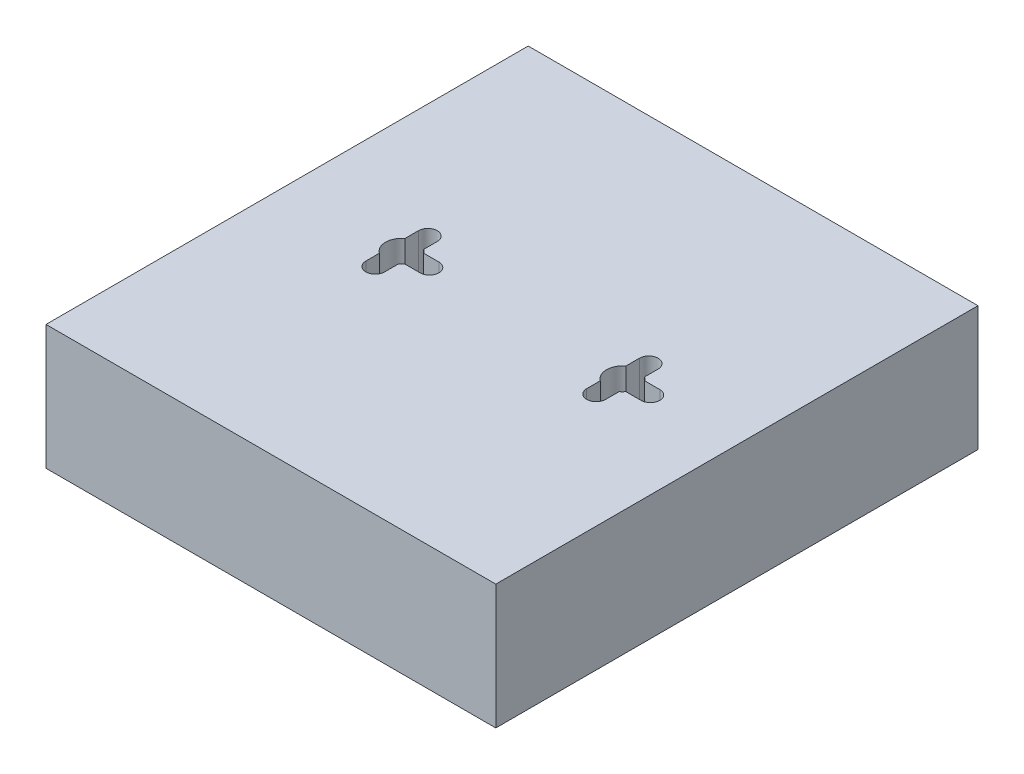
from build123d import *

# Parameters (mm, degrees)
SKETCH1_W           = 94.2086
SKETCH1_H           = 101
BOSS_EXTRUDE1_DEPTH = 26.1
SKETCH2_R           = 5.461
BOSS_EXTRUDE2_DEPTH = 2.54
SKETCH3_W           = 80.593596518
SKETCH3_H           = 16.42098599
CUT_EXTRUDE1_DEPTH  = 5


with BuildPart() as part:
    # Sketch1 → Boss-Extrude1 (new body)
    with BuildSketch(Plane(origin=(0, 0, 0), x_dir=(1, 0, 0), z_dir=(0, 1, 0))):
        with Locations((47.1043, 50.5)):
            Rectangle(SKETCH1_W, SKETCH1_H)
        with BuildLine():
            ThreePointArc((22, 56.0118), (23.9685, 57.9803), (25.937, 56.0118))
            Line((25.937, 56.0118), (25.937, 53.182647668))
            ThreePointArc((25.937, 53.182647668), (26.321327104, 52.852827104), (26.651147668, 52.4685))
            Line((26.651147668, 52.4685), (29.8232, 52.4685))
            ThreePointArc((29.8232, 52.4685), (31.7917, 50.5), (29.8232, 48.5315))
            Line((29.8232, 48.5315), (26.651147668, 48.5315))
            ThreePointArc((26.651147668, 48.5315), (26.321327104, 48.147172896), (25.937, 47.817352332))
            Line((25.937, 47.817352332), (25.937, 44.9882))
            ThreePointArc((25.937, 44.9882), (23.9685, 43.0197), (22, 44.9882))
            Line((22, 44.9882), (22, 47.817352332))
            ThreePointArc((22, 47.817352332), (20.6411, 50.5), (22, 53.182647668))
            Line((22, 53.182647668), (22, 56.0118))
        make_face(mode=Mode.SUBTRACT)
        with BuildLine():
            ThreePointArc((68.2716, 56.0118), (70.2401, 57.9803), (72.2086, 56.0118))
            Line((72.2086, 56.0118), (72.2086, 53.182647668))
            ThreePointArc((72.2086, 53.182647668), (72.592927104, 52.852827104), (72.922747668, 52.4685))
            Line((72.922747668, 52.4685), (76.0948, 52.4685))
            ThreePointArc((76.0948, 52.4685), (78.0633, 50.5), (76.0948, 48.5315))
            Line((76.0948, 48.5315), (72.922747668, 48.5315))
            ThreePointArc((72.922747668, 48.5315), (72.592927104, 48.147172896), (72.2086, 47.817352332))
            Line((72.2086, 47.817352332), (72.2086, 44.9882))
            ThreePointArc((72.2086, 44.9882), (70.2401, 43.0197), (68.2716, 44.9882))
            Line((68.2716, 44.9882), (68.2716, 47.817352332))
            ThreePointArc((68.2716, 47.817352332), (66.9127, 50.5), (68.2716, 53.182647668))
            Line((68.2716, 53.182647668), (68.2716, 56.0118))
        make_face(mode=Mode.SUBTRACT)
    extrude(amount=BOSS_EXTRUDE1_DEPTH)

    # Sketch2 → Boss-Extrude2 (add)
    with BuildSketch(Plane.XZ):
        with Locations(Location((11.938, -20.32, 0), (0, 0, 90))):
            Circle(SKETCH2_R)
        with Locations(Location((82.2706, -20.32, 0), (0, 0, 90))):
            Circle(SKETCH2_R)
        with Locations(Location((11.938, -85.76, 0), (0, 0, 90))):
            Circle(SKETCH2_R)
        with Locations(Location((82.2706, -85.76, 0), (0, 0, 90))):
            Circle(SKETCH2_R)
    extrude(amount=BOSS_EXTRUDE2_DEPTH)

    # Sketch3 → Cut-Extrude1 (cut)
    with BuildSketch(Plane(origin=(0, 0, -101), x_dir=(-1, 0, 0), z_dir=(0, 0, -1))):
        with Locations((-47.1043, 13.05)):
            Rectangle(SKETCH3_W, SKETCH3_H)
    extrude(amount=-CUT_EXTRUDE1_DEPTH, mode=Mode.SUBTRACT)


solid = part.part
